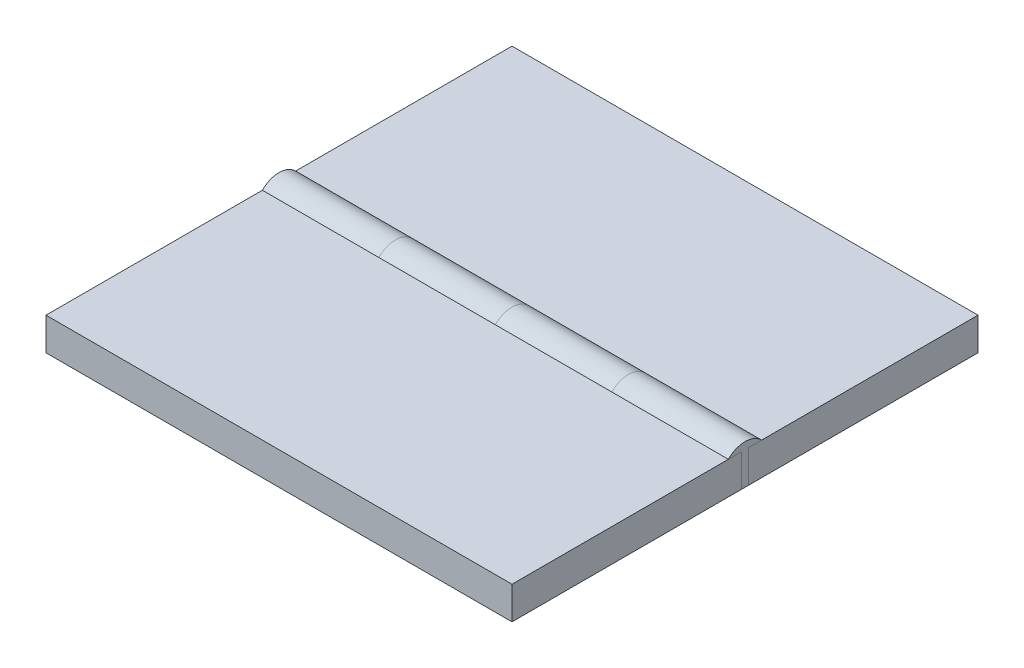
from build123d import *

# Parameters (mm, degrees)
SKETCH1_W             = 49.25
SKETCH1_H             = 7
BOSS_EXTRUDE1_DEPTH   = 100
BOSS_EXTRUDE1_2_DEPTH = 100
BOSS_EXTRUDE2_DEPTH   = 25
BOSS_EXTRUDE3_DEPTH   = 25
BOSS_EXTRUDE4_DEPTH   = 25
BOSS_EXTRUDE5_DEPTH   = 25


with BuildPart() as part:
    # Sketch1 → Boss-Extrude1 (new body)
    with BuildSketch(Plane(origin=(0, 0, 0), x_dir=(0, 0, -1), z_dir=(1, 0, 0))):
        with Locations((-25.375, 0)):
            Rectangle(SKETCH1_W, SKETCH1_H)
    extrude(amount=BOSS_EXTRUDE1_DEPTH)


with BuildPart() as body_2:
    # Sketch1 → Boss-Extrude1 2 (new body)
    with BuildSketch(Plane(origin=(0, 0, 0), x_dir=(0, 0, -1), z_dir=(1, 0, 0))):
        with Locations((25.375, 0)):
            Rectangle(SKETCH1_W, SKETCH1_H)
    extrude(amount=BOSS_EXTRUDE1_2_DEPTH)


with BuildPart() as body_3:
    # Sketch2 → Boss-Extrude2 (new body)
    with BuildSketch(Plane.ZY):
        with BuildLine():
            Line((-0.75, -3.5), (0.75, -3.5))
            Line((0.75, -3.5), (0.75, 3.5))
            Line((0.75, 3.5), (3.570714214, 3.5))
            ThreePointArc((3.570714214, 3.5), (0, 5), (-3.570714214, 3.5))
            Line((-3.570714214, 3.5), (-0.75, 3.5))
            Line((-0.75, 3.5), (-0.75, -3.5))
        make_face()
    extrude(amount=-BOSS_EXTRUDE2_DEPTH)


with BuildPart() as body_4:
    # Sketch3 → Boss-Extrude3 (new body)
    with BuildSketch(Plane(origin=(25, 0, 0), x_dir=(0, 0, -1), z_dir=(1, 0, 0))):
        with BuildLine():
            Line((-3.570714214, 3.5), (-0.75, 3.5))
            Line((-0.75, 3.5), (-0.75, -3.5))
            Line((-0.75, -3.5), (0.75, -3.5))
            Line((0.75, -3.5), (0.75, 3.5))
            Line((0.75, 3.5), (3.570714214, 3.5))
            ThreePointArc((3.570714214, 3.5), (0, 5), (-3.570714214, 3.5))
        make_face()
    extrude(amount=BOSS_EXTRUDE3_DEPTH)


with BuildPart() as body_5:
    # Sketch4 → Boss-Extrude4 (new body)
    with BuildSketch(Plane(origin=(50, 0, 0), x_dir=(0, 0, -1), z_dir=(1, 0, 0))):
        with BuildLine():
            Line((-3.570714214, 3.5), (-0.75, 3.5))
            Line((-0.75, 3.5), (-0.75, -3.5))
            Line((-0.75, -3.5), (0.75, -3.5))
            Line((0.75, -3.5), (0.75, 3.5))
            Line((0.75, 3.5), (3.570714214, 3.5))
            ThreePointArc((3.570714214, 3.5), (0, 5), (-3.570714214, 3.5))
        make_face()
    extrude(amount=BOSS_EXTRUDE4_DEPTH)


with BuildPart() as body_6:
    # Sketch5 → Boss-Extrude5 (new body)
    with BuildSketch(Plane(origin=(75, 0, 0), x_dir=(0, 0, -1), z_dir=(1, 0, 0))):
        with BuildLine():
            Line((-3.570714214, 3.5), (-0.75, 3.5))
            Line((-0.75, 3.5), (-0.75, -3.5))
            Line((-0.75, -3.5), (0.75, -3.5))
            Line((0.75, -3.5), (0.75, 3.5))
            Line((0.75, 3.5), (3.570714214, 3.5))
            ThreePointArc((3.570714214, 3.5), (0, 5), (-3.570714214, 3.5))
        make_face()
    extrude(amount=BOSS_EXTRUDE5_DEPTH)


solid = Compound([part.part, body_2.part, body_3.part, body_4.part, body_5.part, body_6.part])
